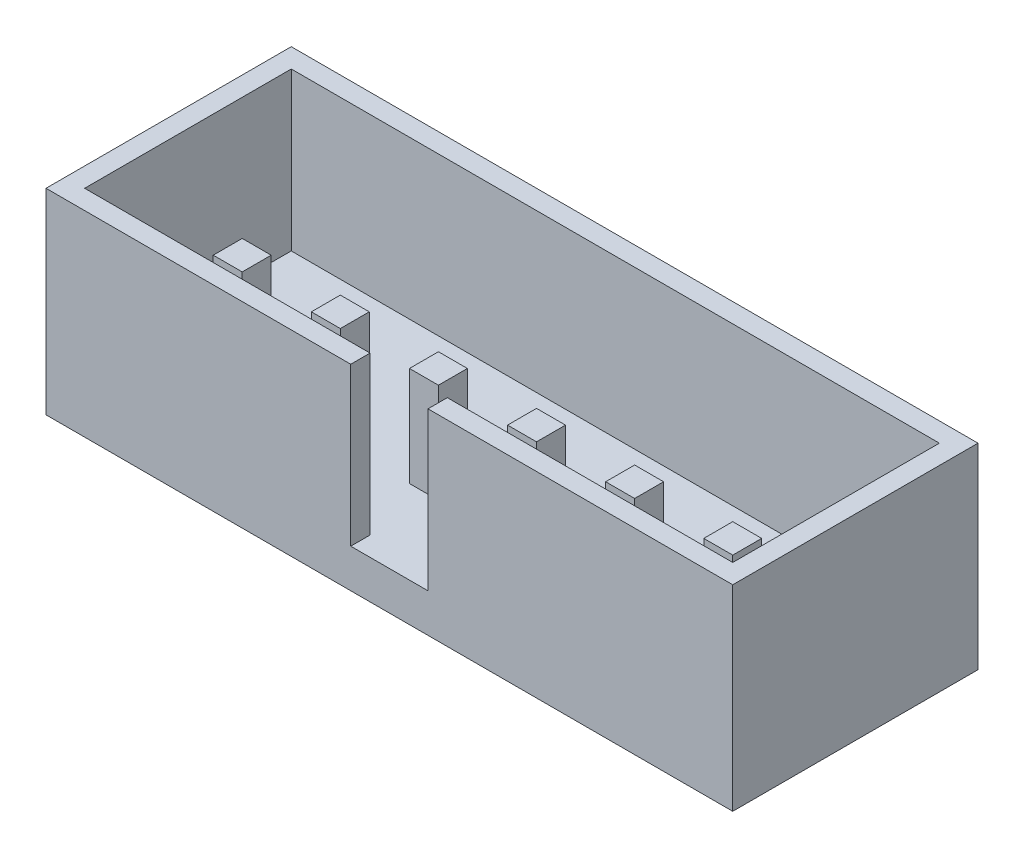
from build123d import *

# Parameters (mm, degrees)
SKETCH_1_W           = 17.78
SKETCH_1_H           = 6.35
EXTRUDE_1_DEPTH      = 5.08
SKETCH_2_W           = 16.78
SKETCH_2_H           = 5.35
CUT_EXTRUDE_1_DEPTH  = 4.08
SKETCH_3_W           = 2
SKETCH_3_H           = 4.08
CUT_EXTRUDE_2_DEPTH  = 1
EXTRUDE_2_DEPTH      = 2
EXTRUDE_2_DEPTH_BACK = 3.58
SKETCH_4_W           = 0.75
SKETCH_4_H           = 0.75


with BuildPart() as part:
    # 草图1 → 拉伸1 (new body)
    with BuildSketch(Plane(origin=(0, 0, 0), x_dir=(1, 0, 0), z_dir=(0, 1, 0))):
        Rectangle(SKETCH_1_W, SKETCH_1_H)
    extrude(amount=EXTRUDE_1_DEPTH)

    # 草图2 → 切除-拉伸1 (cut)
    with BuildSketch(Plane(origin=(0, 5.08, 0), x_dir=(-1, 0, 0), z_dir=(0, 1, 0))):
        Rectangle(SKETCH_2_W, SKETCH_2_H)
    extrude(amount=-CUT_EXTRUDE_1_DEPTH, mode=Mode.SUBTRACT)

    # 草图3 → 切除-拉伸2 (cut)
    with BuildSketch(Plane.XY.offset(3.175)):
        with Locations((0, 3.04)):
            Rectangle(SKETCH_3_W, SKETCH_3_H)
    extrude(amount=-CUT_EXTRUDE_2_DEPTH, mode=Mode.SUBTRACT)

    # 草图4 → 拉伸2 (add, two sides: drawn at the far end of the back side and taken through both)
    with BuildSketch(Plane.XZ.offset(-EXTRUDE_2_DEPTH_BACK)):
        with Locations((-1.27, 0.635)):
            Rectangle(SKETCH_4_W, SKETCH_4_H)
        with Locations((1.27, 0.635)):
            Rectangle(SKETCH_4_W, SKETCH_4_H)
        with Locations((3.81, 0.635)):
            Rectangle(SKETCH_4_W, SKETCH_4_H)
        with Locations((6.35, 0.635)):
            Rectangle(SKETCH_4_W, SKETCH_4_H)
        with Locations((-3.81, 0.635)):
            Rectangle(SKETCH_4_W, SKETCH_4_H)
        with Locations((-6.35, 0.635)):
            Rectangle(SKETCH_4_W, SKETCH_4_H)
    extrude(amount=EXTRUDE_2_DEPTH + EXTRUDE_2_DEPTH_BACK)


solid = part.part
